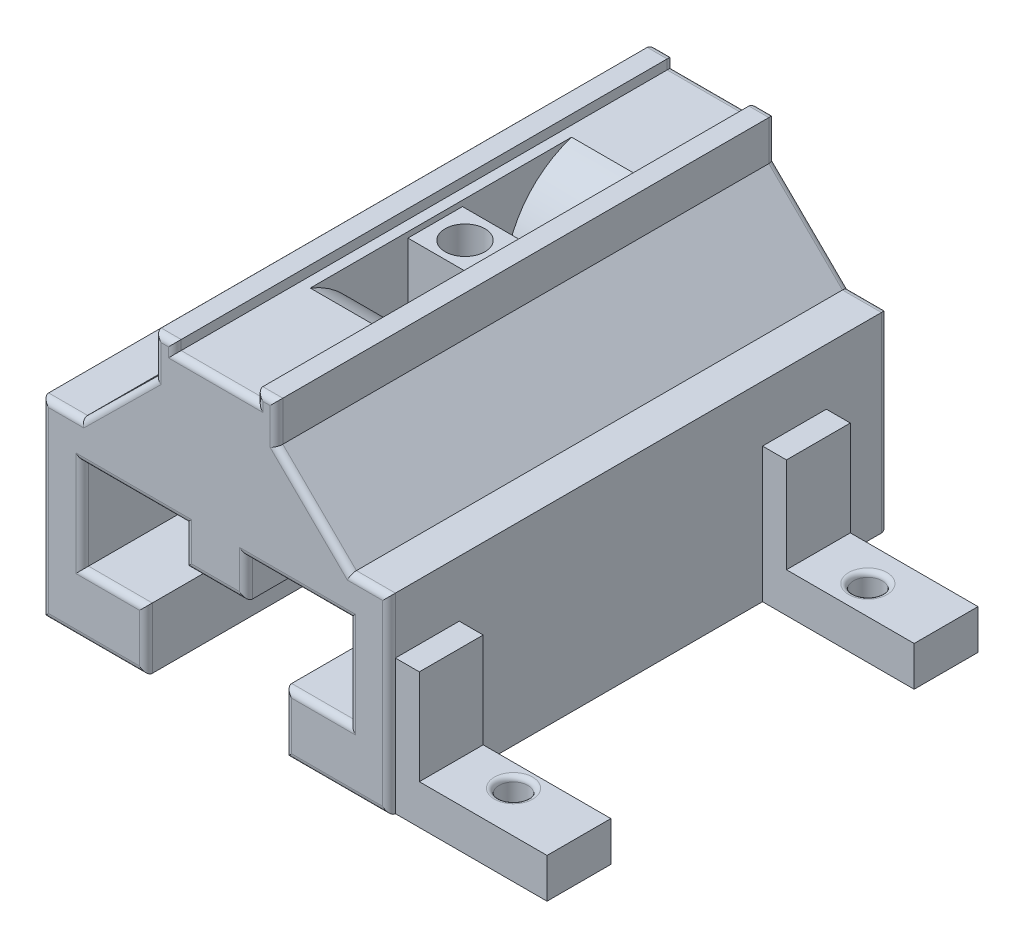
from build123d import *

# Parameters (mm, degrees)
BOSS_EXTRUDE1_DEPTH = 39.6875
SKETCH3_R           = 1.5875
CUT_EXTRUDE1_DEPTH  = 39.6875
CUT_EXTRUDE3_DEPTH  = 5
CUT_EXTRUDE5_DEPTH  = 6.5
FILLET1_R           = 0.508
SKETCH7_W           = 5.08
SKETCH7_H           = 10.72628101
BOSS_EXTRUDE2_DEPTH = 1.905
SKETCH8_W           = 5.08
SKETCH8_H           = 3.15692897
BOSS_EXTRUDE3_DEPTH = 10.16
CUT_EXTRUDE7_REACH  = 55.172
SKETCH9_R           = 1.143
FILLET2_R           = 0.381


with BuildPart() as part:
    # Sketch2 → Boss-Extrude1 (new body)
    with BuildSketch(Plane.XY):
        Polygon((-5.545, 3.02911179), (-10.62, 3.02911179), (-10.62, 10.33111179), (-2.42, 10.33111179), (-2.42, 7.28311179), (2.42, 7.28311179), (2.42, 10.33111179), (10.62, 10.33111179), (10.62, 3.02911179), (5.545, 3.02911179), (5.545, -1.82088821), (13.795, -1.82088821), (13.795, 13.37911179), (10.695, 13.37911179), (4.8375, 19.15761179), (4.8375, 22.33261179), (3.25, 22.33261179), (3.25, 21.57061179), (-3.25, 21.57061179), (-3.25, 22.33261179), (-4.8375, 22.33261179), (-4.8375, 19.15761179), (-10.695, 13.37911179), (-13.795, 13.37911179), (-13.795, -1.82088821), (-5.545, -1.82088821), align=None)
    extrude(amount=BOSS_EXTRUDE1_DEPTH)

    # Sketch3 → Cut-Extrude1 (cut)
    with BuildSketch(Plane(origin=(0, 21.57061179, 0), x_dir=(1, 0, 0), z_dir=(0, 1, 0))):
        with Locations(Location((0, -19.84375, 0), (0, 0, 270))):
            Circle(SKETCH3_R)
    extrude(amount=-CUT_EXTRUDE1_DEPTH, mode=Mode.SUBTRACT)

    # Sketch4 → Cut-Extrude3 (cut)
    with BuildSketch(Plane.XZ.offset(-7.28311179)):
        Polygon((2.078460969, 16.24375), (4.156921938, 19.84375), (2.078460969, 23.44375), (-2.078460969, 23.44375), (-4.156921938, 19.84375), (-2.078460969, 16.24375), align=None)
    extrude(amount=-CUT_EXTRUDE3_DEPTH, mode=Mode.SUBTRACT)

    # Sketch5 → Cut-Extrude5 (cut)
    with BuildSketch(Plane.ZY.offset(2.42)):
        with BuildLine():
            Line((30.935486639, 21.929608435), (6.793752093, 21.929608435))
            ThreePointArc((6.793752093, 21.929608435), (14.106882481, 15.699384594), (9.473965766, 7.28311179))
            Line((9.473965766, 7.28311179), (17.626036587, 7.28311179))
            Line((17.626036587, 7.28311179), (17.626036587, 21.128362833))
            Line((17.626036587, 21.128362833), (21.966828552, 21.128362833))
            Line((21.966828552, 21.128362833), (21.966828552, 7.28311179))
            Line((21.966828552, 7.28311179), (30.118899373, 7.28311179))
            ThreePointArc((30.118899373, 7.28311179), (24.926702023, 14.918604722), (30.935486639, 21.929608435))
        make_face()
    extrude(amount=-CUT_EXTRUDE5_DEPTH, mode=Mode.SUBTRACT)

    # Fillet1
    fillet1_edges = [part.edges().sort_by_distance(p)[0] for p in [
        (-13.795, 5.77911179, 39.6875),
        (-9.67, -1.82088821, 39.6875),
        (-10.62, 6.68011179, 39.6875),
        (-6.52, 10.33111179, 39.6875),
        (-2.42, 8.80711179, 39.6875),
        (-9.67, -1.82088821, 0),
        (0, 7.28311179, 39.6875),
        (-13.795, 5.77911179, 0),
        (-12.245, 13.37911179, 0),
        (-7.76625, 16.26836179, 0),
        (-4.8375, 20.74511179, 0),
        (-4.04375, 22.33261179, 0),
        (-3.25, 21.95161179, 0),
        (0, 21.57061179, 0),
        (3.25, 21.95161179, 0),
        (4.04375, 22.33261179, 0),
        (4.8375, 20.74511179, 0),
        (2.42, 8.80711179, 39.6875),
        (7.76625, 16.26836179, 0),
        (12.245, 13.37911179, 0),
        (13.795, 5.77911179, 0),
        (9.67, -1.82088821, 0),
        (5.545, 0.60411179, 0),
        (8.0825, 3.02911179, 0),
        (10.62, 6.68011179, 0),
        (6.52, 10.33111179, 0),
        (2.42, 8.80711179, 0),
        (0, 7.28311179, 0),
        (6.52, 10.33111179, 39.6875),
        (-2.42, 8.80711179, 0),
        (-6.52, 10.33111179, 0),
        (-10.62, 6.68011179, 0),
        (-8.0825, 3.02911179, 0),
        (-5.545, 0.60411179, 0),
        (10.62, 6.68011179, 39.6875),
        (8.0825, 3.02911179, 39.6875),
        (5.545, 0.60411179, 39.6875),
        (9.67, -1.82088821, 39.6875),
        (-5.545, 0.60411179, 39.6875),
        (13.795, 5.77911179, 39.6875),
        (12.245, 13.37911179, 39.6875),
        (7.76625, 16.26836179, 39.6875),
        (4.8375, 20.74511179, 39.6875),
        (4.04375, 22.33261179, 39.6875),
        (3.25, 21.95161179, 39.6875),
        (0, 21.57061179, 39.6875),
        (-3.25, 21.95161179, 39.6875),
        (-4.04375, 22.33261179, 39.6875),
        (-4.8375, 20.74511179, 39.6875),
        (-8.0825, 3.02911179, 39.6875),
        (-7.76625, 16.26836179, 39.6875),
        (-12.245, 13.37911179, 39.6875),
    ]]
    fillet(fillet1_edges, radius=FILLET1_R)

    # Sketch7 → Boss-Extrude2 (add)
    with BuildSketch(Plane(origin=(13.795, 0, 0), x_dir=(0, 0, -1), z_dir=(1, 0, 0))):
        with Locations((-36.6395, 3.542252295)):
            Rectangle(SKETCH7_W, SKETCH7_H)
        with Locations((-7.4295, 3.542252295)):
            Rectangle(SKETCH7_W, SKETCH7_H)
    extrude(amount=BOSS_EXTRUDE2_DEPTH)

    # Sketch8 → Boss-Extrude3 (add)
    with BuildSketch(Plane(origin=(15.7, 0, 0), x_dir=(0, 0, -1), z_dir=(1, 0, 0))):
        with Locations((-36.6395, -0.242423725)):
            Rectangle(SKETCH8_W, SKETCH8_H)
        with Locations((-7.4295, -0.242423725)):
            Rectangle(SKETCH8_W, SKETCH8_H)
    extrude(amount=BOSS_EXTRUDE3_DEPTH)

    # Sketch9 → Cut-Extrude7 (cut, up to next)
    with BuildSketch(Plane.XZ.offset(1.82088821), mode=Mode.PRIVATE) as cut_extrude7_sk1:
        with Locations((19.891, 35.8775)):
            Circle(SKETCH9_R)
    cut_extrude7_tool1 = extrude(cut_extrude7_sk1.sketch, amount=-CUT_EXTRUDE7_REACH, mode=Mode.PRIVATE) & part.part
    # Sketch9 → Cut-Extrude7 (cut, up to next)
    with BuildSketch(Plane.XZ.offset(1.82088821), mode=Mode.PRIVATE) as cut_extrude7_sk2:
        with Locations((19.891, 7.6835)):
            Circle(SKETCH9_R)
    cut_extrude7_tool2 = extrude(cut_extrude7_sk2.sketch, amount=-CUT_EXTRUDE7_REACH, mode=Mode.PRIVATE) & part.part
    add(cut_extrude7_tool1.solids().sort_by_distance((19.891, -1.820888, 35.8775))[0], mode=Mode.SUBTRACT)
    add(cut_extrude7_tool2.solids().sort_by_distance((19.891, -1.820888, 7.6835))[0], mode=Mode.SUBTRACT)

    # Fillet2
    fillet2_edges = [part.edges().sort_by_distance(p)[0] for p in [
        (18.748, 1.33604076, 35.8775),
        (18.748, -1.82088821, 35.8775),
        (18.748, 1.33604076, 7.6835),
        (18.748, -1.82088821, 7.6835),
    ]]
    fillet(fillet2_edges, radius=FILLET2_R)


solid = part.part
